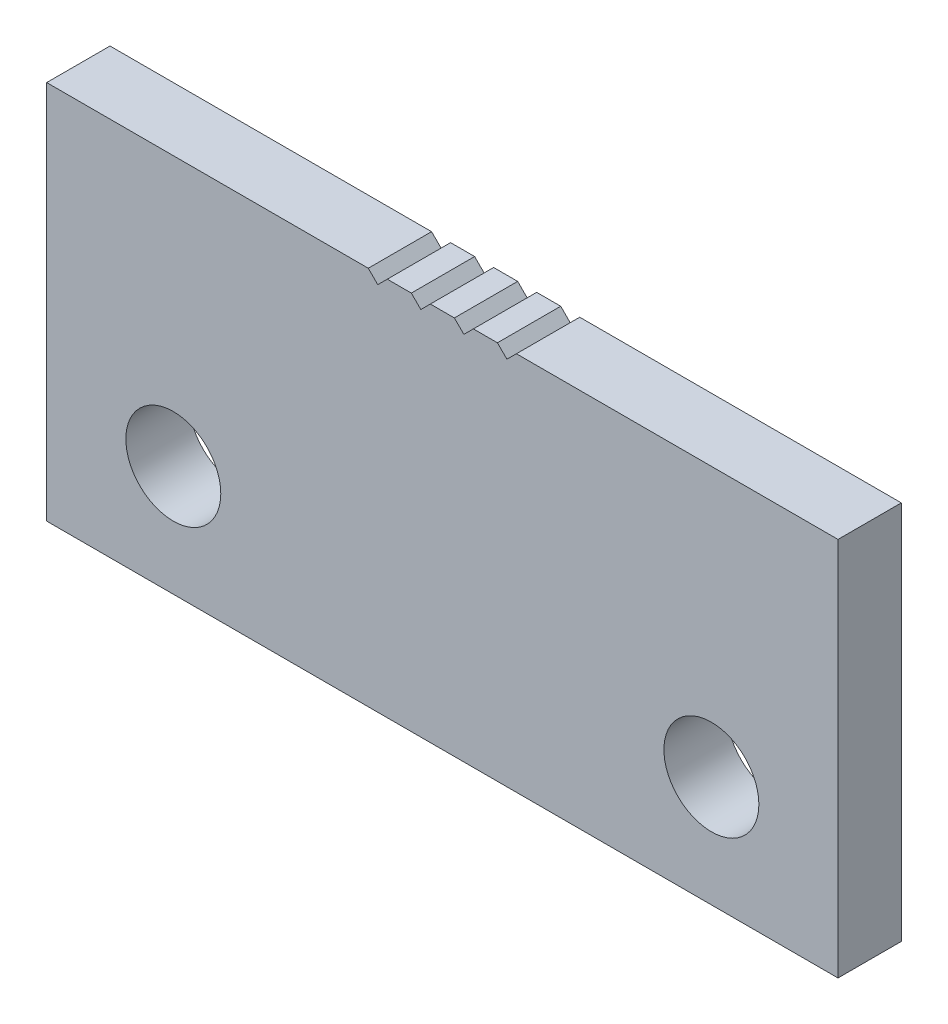
from build123d import *

# Parameters (mm, degrees)
SKETCH1_R           = 1.5
BOSS_EXTRUDE1_DEPTH = 2


with BuildPart() as part:
    # Sketch1 → Boss-Extrude1 (new body)
    with BuildSketch(Plane.XY):
        Polygon((-2.34, 6), (-2.04, 5.7), (-1.74, 6), (-0.98, 6), (-0.68, 5.7), (-0.38, 6), (0.38, 6), (0.68, 5.7), (0.98, 6), (1.74, 6), (2.04, 5.7), (2.34, 6), (12.5, 6), (12.5, -6), (-12.5, -6), (-12.5, 6), align=None)
        with Locations((8.5, -2.5)):
            Circle(SKETCH1_R, mode=Mode.SUBTRACT)
        with Locations((-8.5, -2.5)):
            Circle(SKETCH1_R, mode=Mode.SUBTRACT)
    extrude(amount=BOSS_EXTRUDE1_DEPTH)


solid = part.part
